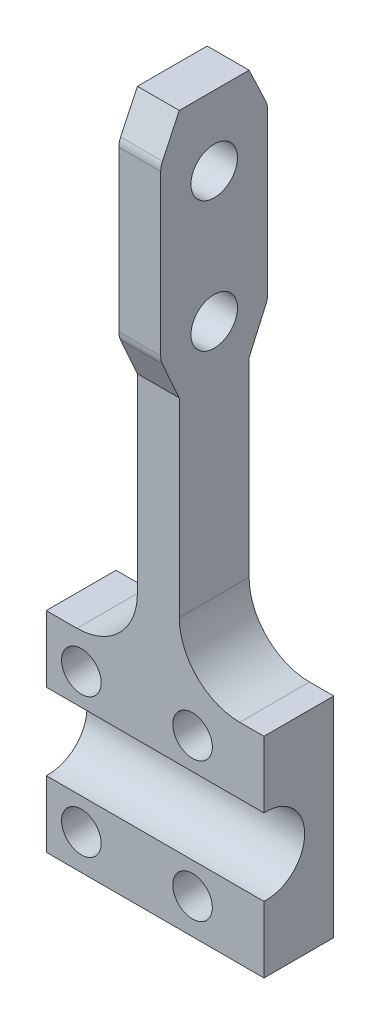
from build123d import *

# Parameters (mm, degrees)
SKETCH1_R           = 4.25
BOSS_EXTRUDE1_DEPTH = 15
SKETCH3_R           = 8.25
CUT_EXTRUDE1_DEPTH  = 55.05
SKETCH4_R           = 5
CUT_EXTRUDE3_DEPTH  = 46.05
BOSS_EXTRUDE2_DEPTH = 9
FILLET1_R           = 13


with BuildPart() as part:
    # Sketch1 → Boss-Extrude1 (new body)
    with BuildSketch(Plane.XY):
        with BuildLine():
            Line((-8.1, 22.5), (-8.1, 129.9))
            Line((-8.1, 129.9), (0.9, 129.9))
            Line((0.9, 129.9), (0.9, 35.5))
            ThreePointArc((0.9, 35.5), (4.707611845, 26.307611845), (13.9, 22.5))
            Line((13.9, 22.5), (20.5, 22.5))
            Line((20.5, 22.5), (20.5, -22.5))
            Line((20.5, -22.5), (-26.3, -22.5))
            Line((-26.3, -22.5), (-26.3, 22.5))
            Line((-26.3, 22.5), (-8.1, 22.5))
        make_face()
        with Locations((-10.95, -14.95)):
            Circle(SKETCH1_R, mode=Mode.SUBTRACT)
        with Locations((12.95, -14.95)):
            Circle(SKETCH1_R, mode=Mode.SUBTRACT)
        with Locations((12.95, 14.95)):
            Circle(SKETCH1_R, mode=Mode.SUBTRACT)
        with Locations((-10.95, 14.95)):
            Circle(SKETCH1_R, mode=Mode.SUBTRACT)
    extrude(amount=BOSS_EXTRUDE1_DEPTH)

    # Sketch3 → Cut-Extrude1 (cut)
    with BuildSketch(Plane.ZY.offset(26.3)):
        with Locations((14.5, 0)):
            Circle(SKETCH3_R)
    extrude(amount=-CUT_EXTRUDE1_DEPTH, mode=Mode.SUBTRACT)

    # Sketch4 → Cut-Extrude3 (cut)
    with BuildSketch(Plane(origin=(0.9, 0, 0), x_dir=(0, 0, -1), z_dir=(1, 0, 0))):
        with Locations((-7.5, 86.9)):
            Circle(SKETCH4_R)
        with Locations((-7.5, 114.9)):
            Circle(SKETCH4_R)
    extrude(amount=-CUT_EXTRUDE3_DEPTH, mode=Mode.SUBTRACT)

    # Sketch6 → Boss-Extrude2 (add)
    with BuildSketch(Plane.ZY.offset(8.1)):
        with BuildLine():
            Line((15, 76.386851455), (18.651630299, 84.554112306))
            ThreePointArc((18.651630299, 84.554112306), (18.911938215, 85.352068488), (19, 86.186777661))
            Line((19, 86.186777661), (19, 120.550049196))
            ThreePointArc((19, 120.550049196), (18.902685036, 121.427003874), (18.615475246, 122.261288146))
            Line((18.615475246, 122.261288146), (15, 129.9))
            Line((15, 129.9), (15, 76.386851455))
        make_face()
        with BuildLine():
            Line((-3.615475246, 122.261288146), (0, 129.9))
            Line((0, 129.9), (0, 76.386851455))
            Line((0, 76.386851455), (-3.651630299, 84.554112306))
            ThreePointArc((-3.651630299, 84.554112306), (-3.911938215, 85.352068488), (-4, 86.186777661))
            Line((-4, 86.186777661), (-4, 120.550049196))
            ThreePointArc((-4, 120.550049196), (-3.902685036, 121.427003874), (-3.615475246, 122.261288146))
        make_face()
    extrude(amount=-BOSS_EXTRUDE2_DEPTH)

    # Fillet1
    fillet1_edges = [part.edges().sort_by_distance(p)[0] for p in [
        (-8.1, 22.5, 7.5),
    ]]
    fillet(fillet1_edges, radius=FILLET1_R)


with BuildPart() as body_2:
    # Mirror2: mirrored copy
    add(part.part.mirror(Plane(origin=(20.5, -22.5, 15), x_dir=(0, 0, 1), z_dir=(-1, 0, 0))))


solid = body_2.part
